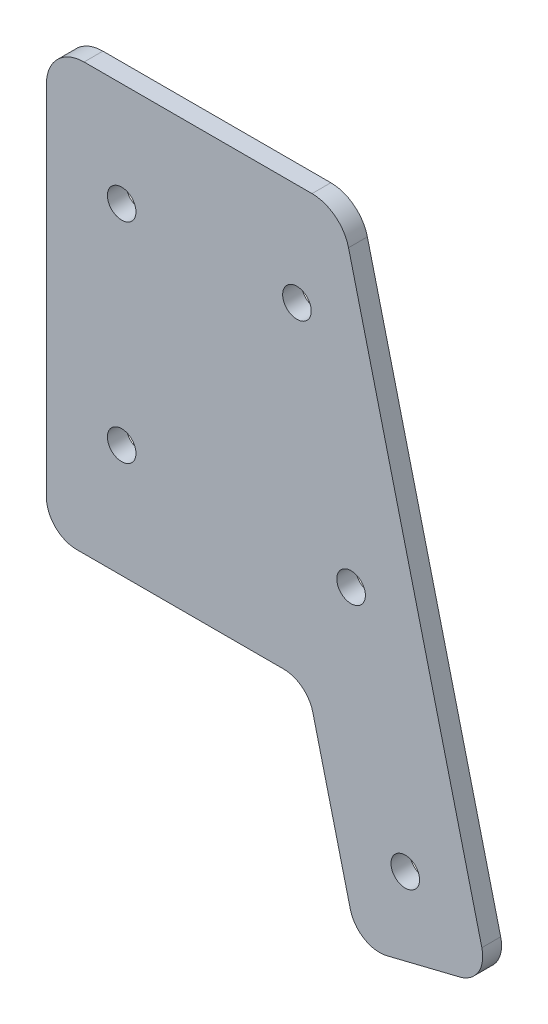
from build123d import *

# Parameters (mm, degrees)
BOSS_EXTRUDE1_DEPTH = 3.175
SKETCH2_R           = 2.413
CUT_EXTRUDE1_DEPTH  = 146.311171514


with BuildPart() as part:
    # Sketch1 → Boss-Extrude1 (new body)
    with BuildSketch(Plane.XY):
        with BuildLine():
            Line((48.510867826, 121.831346212), (71.00638654, 30.794912365))
            ThreePointArc((71.00638654, 30.794912365), (70.423641708, 26.950767781), (67.293358183, 24.6446099))
            Line((67.293358183, 24.6446099), (54.964194654, 21.598017264))
            ThreePointArc((54.964194654, 21.598017264), (51.12005007, 22.180762096), (48.813892189, 25.311045622))
            Line((48.813892189, 25.311045622), (42.484535319, 50.925128378))
            ThreePointArc((42.484535319, 50.925128378), (40.684620517, 53.706308584), (37.552869907, 54.786491324))
            Line((37.552869907, 54.786491324), (2.614167294, 54.786491324))
            ThreePointArc((2.614167294, 54.786491324), (-0.977935154, 56.274388875), (-2.465832706, 59.866491324))
            Line((-2.465832706, 59.866491324), (-2.465832706, 120.308049894))
            ThreePointArc((-2.465832706, 120.308049894), (-0.605960766, 124.798177955), (3.884167294, 126.658049894))
            Line((3.884167294, 126.658049894), (42.346286061, 126.658049894))
            ThreePointArc((42.346286061, 126.658049894), (46.260974324, 125.30782147), (48.510867826, 121.831346212))
        make_face()
    extrude(amount=BOSS_EXTRUDE1_DEPTH)

    # Sketch2 → Cut-Extrude1 (cut, through all)
    with BuildSketch(Plane.XY.offset(3.175)):
        with Locations((58.082183783, 35.450477111)):
            Circle(SKETCH2_R)
        with Locations((48.942405878, 72.437967696)):
            Circle(SKETCH2_R)
        with Locations((39.802627972, 109.425458282)):
            Circle(SKETCH2_R)
        with Locations((10.234167294, 109.132049894)):
            Circle(SKETCH2_R)
        with Locations((10.234167294, 73.836491324)):
            Circle(SKETCH2_R)
    extrude(amount=-CUT_EXTRUDE1_DEPTH, mode=Mode.SUBTRACT)


solid = part.part
